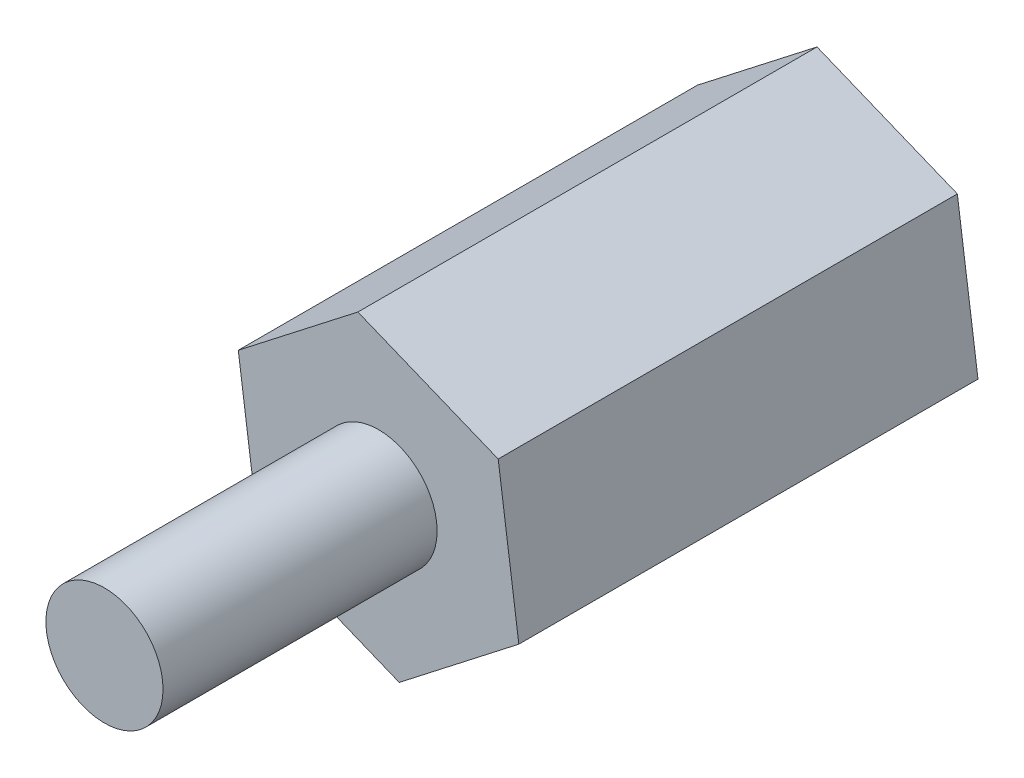
from build123d import *

# Parameters (mm, degrees)
BOSS_EXTRUDE1_DEPTH = 9.9568
SKETCH3_R           = 1.27
CUT_EXTRUDE1_DEPTH  = 7.4168
SKETCH4_R           = 1.27
BOSS_EXTRUDE2_DEPTH = 5.9436


with BuildPart() as part:
    # Sketch1 → Boss-Extrude1 (new body)
    with BuildSketch(Plane.XY):
        Polygon((-2.594183564, -2.015124733), (0.448057428, -3.254191235), (3.042240993, -1.239066502), (2.594183564, 2.015124733), (-0.448057428, 3.254191235), (-3.042240993, 1.239066502), align=None)
    extrude(amount=BOSS_EXTRUDE1_DEPTH)

    # Sketch3 → Cut-Extrude1 (cut)
    with BuildSketch(Plane(origin=(0, 0, 0), x_dir=(-1, 0, 0), z_dir=(0, 0, -1))):
        Circle(SKETCH3_R)
    extrude(amount=-CUT_EXTRUDE1_DEPTH, mode=Mode.SUBTRACT)

    # Sketch4 → Boss-Extrude2 (add)
    with BuildSketch(Plane.XY.offset(9.9568)):
        with Locations(Location((0, 0, 0), (0, 0, 180))):
            Circle(SKETCH4_R)
    extrude(amount=BOSS_EXTRUDE2_DEPTH)


solid = part.part
